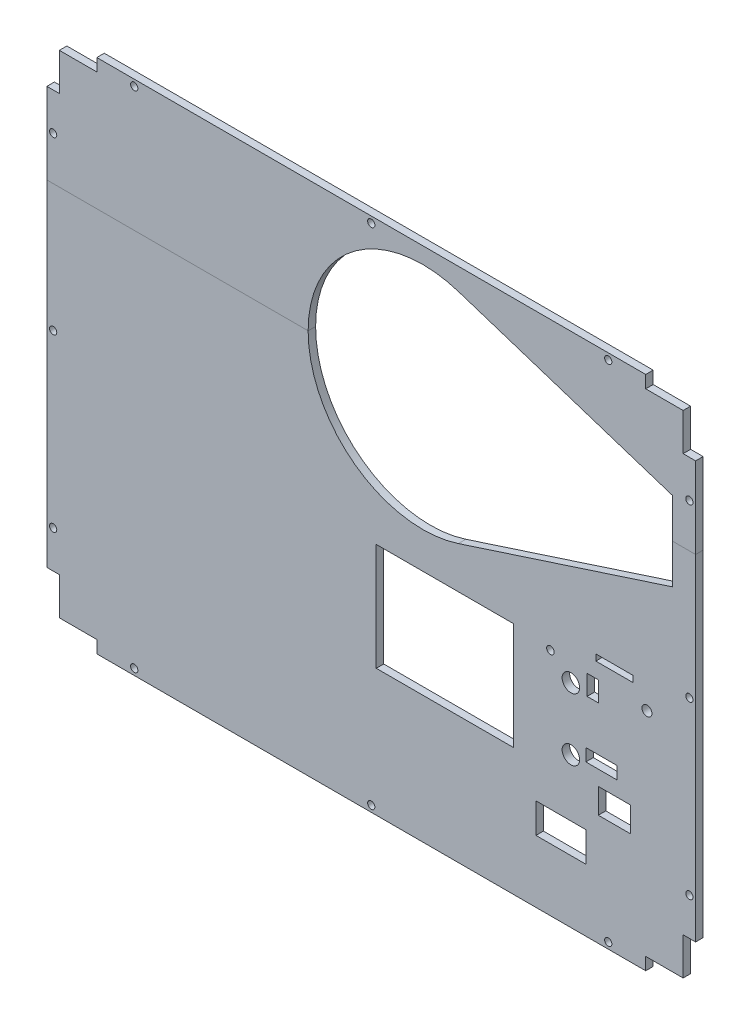
from build123d import *

# Parameters (mm, degrees)
BOSS_EXTRUDE1_DEPTH    = 3
CUT_EXTRUDE1_DEPTH     = 241.235301319
SKETCH3_W              = 55
SKETCH3_H              = 43
CUT_EXTRUDE2_DEPTH     = 241.235301319
SPLIT1_SURFACE_1_BACK  = 333.352
SPLIT1_SURFACE_1_DEPTH = 666.704
SPLIT1_SURFACE_2_BACK  = 333.352
SPLIT1_SURFACE_2_DEPTH = 666.704
SKETCH5_W              = 20
SKETCH5_H              = 12
CUT_EXTRUDE3_DEPTH     = 241.235301319
SKETCH6_R              = 3.5
CUT_EXTRUDE4_DEPTH     = 241.235301319
SKETCH7_R              = 1.45
CUT_EXTRUDE5_DEPTH     = 241.235301319
SKETCH8_R              = 2
SKETCH8_R_2            = 1.5
SKETCH8_W              = 12.5
SKETCH8_H              = 5
SKETCH8_W_2            = 4.5
SKETCH8_H_2            = 8
SKETCH8_W_3            = 15
SKETCH8_H_3            = 2.5
SKETCH8_W_4            = 13
SKETCH8_H_4            = 10
CUT_EXTRUDE6_DEPTH     = 241.235301319


with BuildPart() as part:
    # Sketch1 → Boss-Extrude1 (new body)
    with BuildSketch(Plane.XY):
        Polygon((110, 202), (-110, 202), (-110, 197), (-125, 197), (-125, 182), (-130, 182), (-130, 15), (-125, 15), (-125, 0), (-110, 0), (-110, -5), (110, -5), (110, 0), (125, 0), (125, 15), (130, 15), (130, 182), (125, 182), (125, 197), (110, 197), align=None)
    extrude(amount=BOSS_EXTRUDE1_DEPTH)

    # Sketch2 → Cut-Extrude1 (cut, through all)
    with BuildSketch(Plane.XY.offset(3)):
        with BuildLine():
            Line((34.914781741, 105.75140025), (120.7, 133.624707308))
            Line((120.7, 133.624707308), (120.7, 165.375292692))
            Line((120.7, 165.375292692), (34.914781741, 193.24859975))
            ThreePointArc((34.914781741, 193.24859975), (-25.3, 149.5), (34.914781741, 105.75140025))
        make_face()
    extrude(amount=-CUT_EXTRUDE1_DEPTH, mode=Mode.SUBTRACT)

    # Sketch3 → Cut-Extrude2 (cut, through all)
    with BuildSketch(Plane.XY.offset(3)):
        with Locations((29.5, 67.5)):
            Rectangle(SKETCH3_W, SKETCH3_H)
    extrude(amount=-CUT_EXTRUDE2_DEPTH, mode=Mode.SUBTRACT)


with BuildPart() as body_2:
    # Split1: the piece behind the surface
    add(part.part)
    # Split1 surface: a surface, the sketch's curves swept straight by 666.704 mm
    with BuildLine(Plane.XY.offset(3).offset(-SPLIT1_SURFACE_1_BACK), mode=Mode.PRIVATE) as split1_surface_1_path:
        Line((-130, 149.5), (130, 149.5))
    split1_surface_1 = Shell.extrude(split1_surface_1_path.wire(), (0 * SPLIT1_SURFACE_1_DEPTH, 0 * SPLIT1_SURFACE_1_DEPTH, 1 * SPLIT1_SURFACE_1_DEPTH))
    split(bisect_by=split1_surface_1, keep=Keep.BOTTOM)

    # Sketch5 → Cut-Extrude3 (cut, through all)
    with BuildSketch(Plane.XY.offset(3)):
        with Locations((76, 26)):
            Rectangle(SKETCH5_W, SKETCH5_H)
    extrude(amount=-CUT_EXTRUDE3_DEPTH, mode=Mode.SUBTRACT)

    # Sketch6 → Cut-Extrude4 (cut, through all)
    with BuildSketch(Plane.XY.offset(3)):
        with Locations((80, 55)):
            Circle(SKETCH6_R)
        with Locations((80, 80)):
            Circle(SKETCH6_R)
    extrude(amount=-CUT_EXTRUDE4_DEPTH, mode=Mode.SUBTRACT)


with BuildPart() as part_1:
    add(part.part)

    # Split1: split by a surface, the side it looks to stays
    # Split1 surface: a surface, the sketch's curves swept straight by 666.704 mm
    with BuildLine(Plane.XY.offset(3).offset(-SPLIT1_SURFACE_2_BACK), mode=Mode.PRIVATE) as split1_surface_2_path:
        Line((-130, 149.5), (130, 149.5))
    split1_surface_2 = Shell.extrude(split1_surface_2_path.wire(), (0 * SPLIT1_SURFACE_2_DEPTH, 0 * SPLIT1_SURFACE_2_DEPTH, 1 * SPLIT1_SURFACE_2_DEPTH))
    split(bisect_by=split1_surface_2, keep=Keep.TOP)


with BuildPart() as cut_extrude5_tool:
    # Sketch7 → Cut-Extrude5 (new, through all)
    with BuildSketch(Plane.XY.offset(3)):
        with Locations((-95, 199.5)):
            Circle(SKETCH7_R)
        with Locations((95, 199.5)):
            Circle(SKETCH7_R)
        with Locations((0, 199.5)):
            Circle(SKETCH7_R)
        with Locations((127.5, 167)):
            Circle(SKETCH7_R)
        with Locations((127.5, 98.5)):
            Circle(SKETCH7_R)
        with Locations((127.5, 30)):
            Circle(SKETCH7_R)
        with Locations(Location((95, -2.5, 0), (0, 0, 180))):
            Circle(SKETCH7_R)
        with Locations(Location((0, -2.5, 0), (0, 0, 180))):
            Circle(SKETCH7_R)
        with Locations(Location((-95, -2.5, 0), (0, 0, 180))):
            Circle(SKETCH7_R)
        with Locations(Location((-127.5, 30, 0), (0, 0, 180))):
            Circle(SKETCH7_R)
        with Locations(Location((-127.5, 98.5, 0), (0, 0, 180))):
            Circle(SKETCH7_R)
        with Locations(Location((-127.5, 167, 0), (0, 0, 180))):
            Circle(SKETCH7_R)
    extrude(amount=-CUT_EXTRUDE5_DEPTH)


with BuildPart() as part_2:
    add(part_1.part)

    # Cut-Extrude5: cut by cut_extrude5_tool
    add(cut_extrude5_tool.part, mode=Mode.SUBTRACT)


with BuildPart() as body_2_1:
    add(body_2.part)

    # Cut-Extrude5: cut by cut_extrude5_tool
    add(cut_extrude5_tool.part, mode=Mode.SUBTRACT)

    # Sketch8 → Cut-Extrude6 (cut, through all)
    with BuildSketch(Plane.XY.offset(3)):
        with Locations((110.5, 85.5)):
            Circle(SKETCH8_R)
        with Locations((71.8, 87.2)):
            Circle(SKETCH8_R_2)
        with Locations((92.25, 58)):
            Rectangle(SKETCH8_W, SKETCH8_H)
        with Locations((88.75, 82.5)):
            Rectangle(SKETCH8_W_2, SKETCH8_H_2)
        with Locations((97.5, 93.75)):
            Rectangle(SKETCH8_W_3, SKETCH8_H_3)
        with Locations((97.5, 44.5)):
            Rectangle(SKETCH8_W_4, SKETCH8_H_4)
    extrude(amount=-CUT_EXTRUDE6_DEPTH, mode=Mode.SUBTRACT)


solid = Compound([part_2.part, body_2_1.part])
